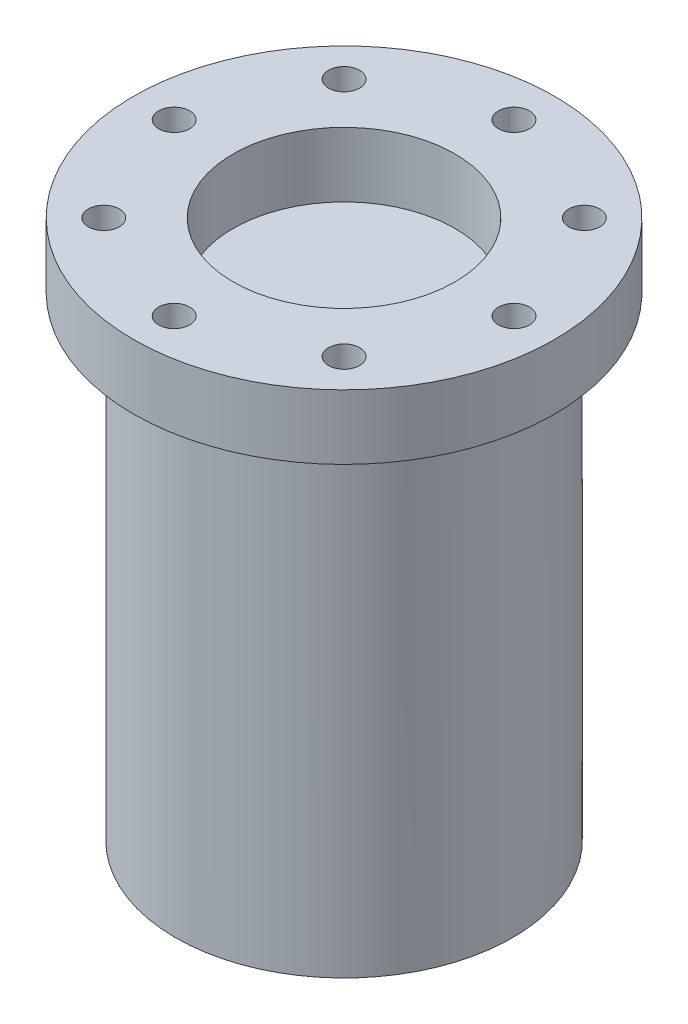
from build123d import *

# Parameters (mm, degrees)
SKETCH1_R           = 57.15
SKETCH1_R_2         = 30.099
EXTRUDE_THIN1_DEPTH = 17.526
SKETCH2_R           = 4.2164
CUT_EXTRUDE2_DEPTH  = 17.526
CIRPATTERN1_COUNT   = 8
SKETCH5_R           = 45.72
EXTRUDE1_DEPTH      = 128.778


with BuildPart() as part:
    # Sketch1 → Extrude-Thin1 (new body)
    with BuildSketch(Plane(origin=(0, 0, 0), x_dir=(1, 0, 0), z_dir=(0, 1, 0))):
        Circle(SKETCH1_R)
        Circle(SKETCH1_R_2, mode=Mode.SUBTRACT)
    extrude(amount=EXTRUDE_THIN1_DEPTH)

    # Sketch2 → Cut-Extrude2 (cut)
    with BuildSketch(Plane(origin=(0, 0, 0), x_dir=(1, 0, 0), z_dir=(0, 1, 0))):
        with Locations((0, 46.101)):
            Circle(SKETCH2_R)
    cut_extrude2 = extrude(amount=CUT_EXTRUDE2_DEPTH, mode=Mode.SUBTRACT)

    # CirPattern1: Cut-Extrude2 ×8 about axis
    cirpattern1_axis = Axis((0, 58.676993495, 0), (0, -1, 0))
    for i in range(1, CIRPATTERN1_COUNT):
        add(cut_extrude2.rotate(cirpattern1_axis, i * 360 / CIRPATTERN1_COUNT), mode=Mode.SUBTRACT)

    # Sketch5 → Extrude1 (add)
    with BuildSketch(Plane.XZ):
        Circle(SKETCH5_R)
    extrude(amount=EXTRUDE1_DEPTH)


solid = part.part
